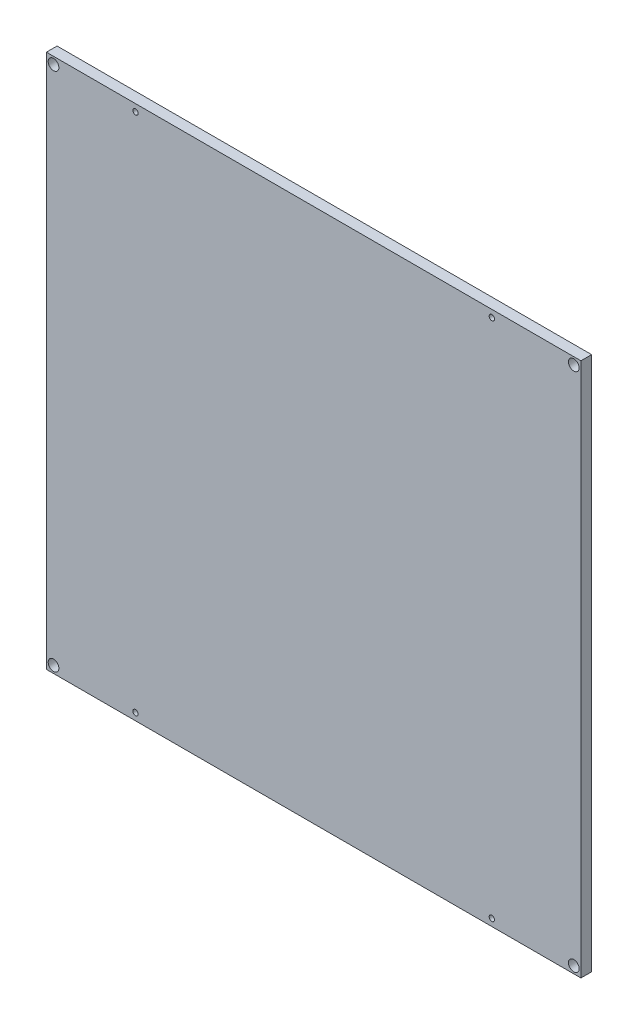
from build123d import *

# Parameters (mm, degrees)
SKETCH2_W               = 300
SKETCH2_H               = 300
BOSS_EXTRUDE1_DEPTH     = 6
SKETCH3_R               = 3
CUT_EXTRUDE1_DEPTH      = 213.216870206
SKETCH5_R               = 1.5
CUT_EXTRUDE2_DEPTH      = 213.216870206
MIRROR4_COPY_1_SKETCH_R = 3
MIRROR4_COPY_1_DEPTH    = 213.216870206
MIRROR4_COPY_2_SKETCH_R = 1.5
MIRROR4_COPY_2_DEPTH    = 213.216870206


with BuildPart() as part:
    # Sketch2 → Boss-Extrude1 (new body)
    with BuildSketch(Plane.XY):
        Rectangle(SKETCH2_W, SKETCH2_H)
    extrude(amount=BOSS_EXTRUDE1_DEPTH)

    # Sketch3 → Cut-Extrude1 (cut, through all)
    with BuildSketch(Plane(origin=(0, 0, 0), x_dir=(-1, 0, 0), z_dir=(0, 0, -1))):
        with Locations((146, 146)):
            Circle(SKETCH3_R)
    cut_extrude1 = extrude(amount=-CUT_EXTRUDE1_DEPTH, mode=Mode.SUBTRACT)

    # Sketch5 → Cut-Extrude2 (cut, through all)
    with BuildSketch(Plane.XY):
        with Locations((-100, 146)):
            Circle(SKETCH5_R)
    cut_extrude2 = extrude(amount=CUT_EXTRUDE2_DEPTH, mode=Mode.SUBTRACT)

    # Mirror3: Cut-Extrude1, Cut-Extrude2 across plane
    add(cut_extrude1.mirror(Plane(origin=(0, 0, 0), x_dir=(0, 0, 1), z_dir=(1, 0, 0))), mode=Mode.SUBTRACT)
    add(cut_extrude2.mirror(Plane(origin=(0, 0, 0), x_dir=(0, 0, 1), z_dir=(1, 0, 0))), mode=Mode.SUBTRACT)

    # Mirror4: Cut-Extrude1, Cut-Extrude2 across plane
    add(cut_extrude1.mirror(Plane.ZX), mode=Mode.SUBTRACT)
    add(cut_extrude2.mirror(Plane.ZX), mode=Mode.SUBTRACT)

    # Mirror4 copy 1 sketch → Mirror4 copy 1 (cut, through all)
    with BuildSketch(Plane(origin=(0, 0, 0), x_dir=(1, 0, 0), z_dir=(0, 0, -1))):
        with Locations((146, 146)):
            Circle(MIRROR4_COPY_1_SKETCH_R)
    extrude(amount=-MIRROR4_COPY_1_DEPTH, mode=Mode.SUBTRACT)

    # Mirror4 copy 2 sketch → Mirror4 copy 2 (cut, through all)
    with BuildSketch(Plane(origin=(0, 0, 0), x_dir=(-1, 0, 0), z_dir=(0, 0, 1))):
        with Locations((-100, 146)):
            Circle(MIRROR4_COPY_2_SKETCH_R)
    extrude(amount=MIRROR4_COPY_2_DEPTH, mode=Mode.SUBTRACT)


solid = part.part
